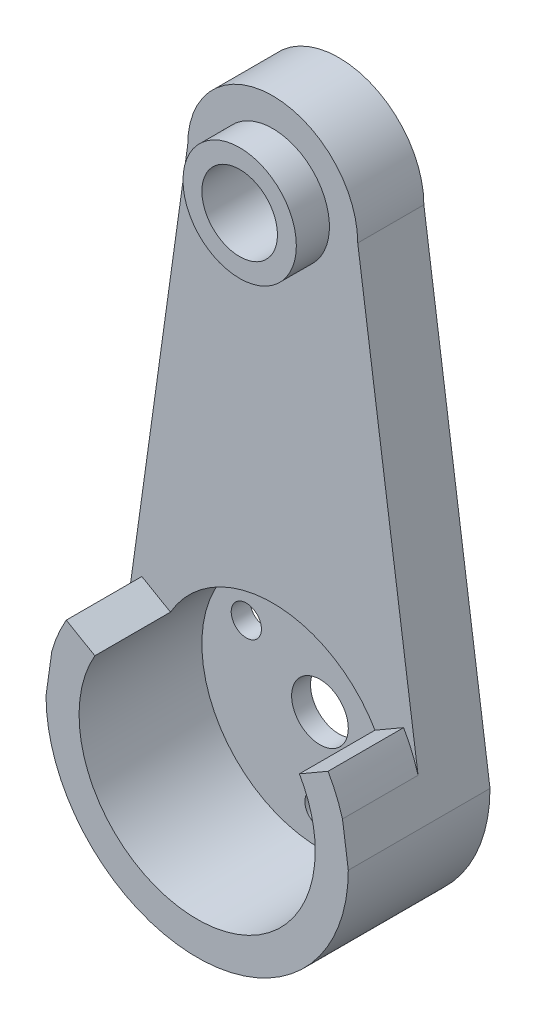
from build123d import *

# Parameters (mm, degrees)
BOSS_EXTRU_1_DEPTH      = 7
ESQUISSE2_R             = 3
ENL_V_MAT_EXTRU_1_DEPTH = 7
ESQUISSE3_R             = 1.6
ENL_V_MAT_EXTRU_2_DEPTH = 7
ESQUISSE5_R             = 12.5
ENL_V_MAT_EXTRU_5_DEPTH = 5
ESQUISSE17_R            = 6
ESQUISSE17_R_2          = 4
BOSS_EXTRU_6_DEPTH      = 3.5
BOSS_EXTRU_8_DEPTH      = 8
ENL_V_START             = -8
ESQUISSE19_R            = 4
ENL_V_MAT_EXTRU_6_DEPTH = 8


with BuildPart() as part:
    # Esquisse1 → Boss.-Extru.1 (new body)
    with BuildSketch(Plane.XY):
        with BuildLine():
            Line((9, 0), (16, -50))
            ThreePointArc((16, -50), (0, -66), (-16, -50))
            Line((-16, -50), (-9, 0))
            ThreePointArc((-9, 0), (0, 9), (9, 0))
        make_face()
    extrude(amount=BOSS_EXTRU_1_DEPTH)

    # Esquisse2 → Enlèv. mat.-Extru.1 (cut)
    with BuildSketch(Plane.XY.offset(7)):
        with Locations((0, -50)):
            Circle(ESQUISSE2_R)
    extrude(amount=-ENL_V_MAT_EXTRU_1_DEPTH, mode=Mode.SUBTRACT)

    # Esquisse3 → Enlèv. mat.-Extru.2 (cut)
    with BuildSketch(Plane.XY.offset(7)):
        with Locations((0, -59)):
            Circle(ESQUISSE3_R)
        with Locations((-7.794228634, -45.5)):
            Circle(ESQUISSE3_R)
        with Locations((7.794228634, -45.5)):
            Circle(ESQUISSE3_R)
    extrude(amount=-ENL_V_MAT_EXTRU_2_DEPTH, mode=Mode.SUBTRACT)

    # Esquisse5 → Enlèv. mat.-Extru.5 (cut)
    with BuildSketch(Plane.XY.offset(7)):
        with Locations((0, -50)):
            Circle(ESQUISSE5_R)
    extrude(amount=-ENL_V_MAT_EXTRU_5_DEPTH, mode=Mode.SUBTRACT)

    # Esquisse17 → Boss.-Extru.6 (add)
    with BuildSketch(Plane.XY.offset(7)):
        with Locations(Location((0, 0, 0), (0, 0, 180))):
            Circle(ESQUISSE17_R)
        Circle(ESQUISSE17_R_2, mode=Mode.SUBTRACT)
    extrude(amount=BOSS_EXTRU_6_DEPTH)

    # Esquisse18 → Boss.-Extru.8 (add)
    with BuildSketch(Plane.XY.offset(7)):
        with BuildLine():
            Line((-10.825317547, -43.75), (-13.856406461, -42))
            ThreePointArc((-13.856406461, -42), (-14.731391476, -43.756114576), (-15.384856807, -45.606120047))
            Line((-15.384856807, -45.606120047), (-16, -50))
            ThreePointArc((-16, -50), (0, -66), (16, -50))
            Line((16, -50), (15.384856807, -45.606120047))
            ThreePointArc((15.384856807, -45.606120047), (14.731391476, -43.756114576), (13.856406461, -42))
            Line((13.856406461, -42), (10.825317547, -43.75))
            ThreePointArc((10.825317547, -43.75), (12.074072829, -46.764761936), (12.5, -50))
            ThreePointArc((12.5, -50), (-3.235238064, -62.074072829), (-10.825317547, -43.75))
        make_face()
    extrude(amount=BOSS_EXTRU_8_DEPTH)

    # Esquisse19 → Enlèv. mat.-Extru.6 (cut)
    with BuildSketch(Plane.XY.offset(7).offset(ENL_V_START)):
        with Locations(Location((0, 0, 0), (0, 0, 180))):
            Circle(ESQUISSE19_R)
    extrude(amount=ENL_V_MAT_EXTRU_6_DEPTH, mode=Mode.SUBTRACT)


solid = part.part
